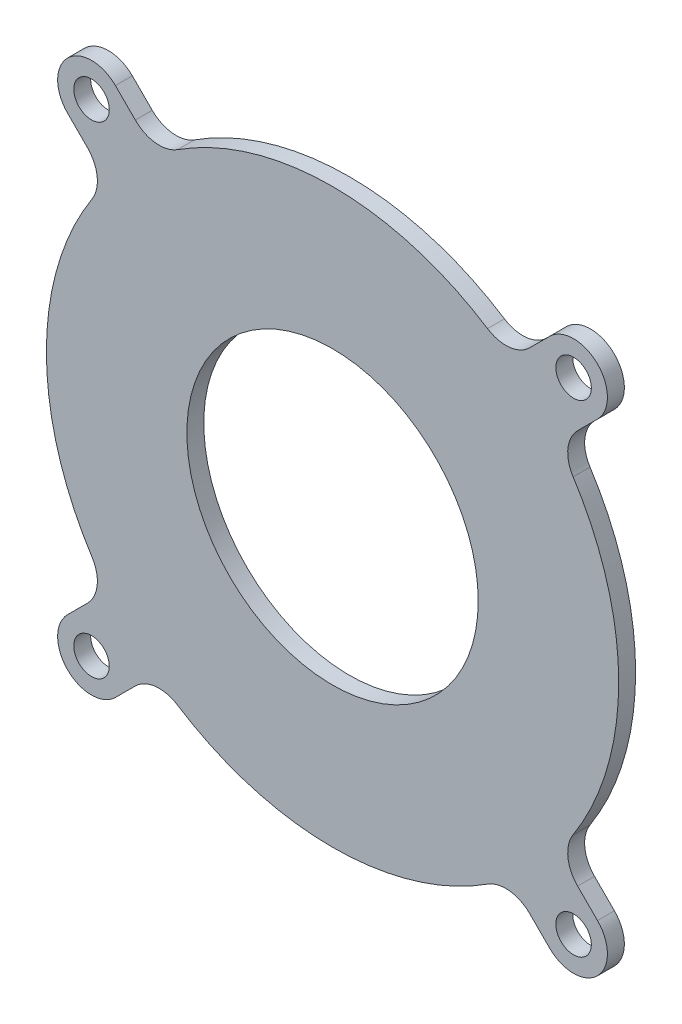
from build123d import *

# Parameters (mm, degrees)
SKETCH_1_R      = 2.1
SKETCH_1_R_2    = 17.225
EXTRUDE_1_DEPTH = 2


with BuildPart() as part:
    # 草图1 → 凸台-拉伸1 (new body)
    with BuildSketch(Plane.XY):
        with BuildLine():
            Line((49.221320344, -54.878174593), (46.870064467, -52.526918716))
            ThreePointArc((46.870064467, -52.526918716), (44.466937039, -51.378020085), (41.875216055, -51.992814233))
            ThreePointArc((41.875216055, -51.992814233), (23.55, -57.385), (5.224783944, -51.992814233))
            ThreePointArc((5.224783944, -51.992814233), (2.633062961, -51.378020085), (0.229935533, -52.526918716))
            Line((0.229935533, -52.526918716), (-2.121320344, -54.878174593))
            ThreePointArc((-2.121320344, -54.878174593), (-7.778174593, -54.878174593), (-7.778174593, -49.221320343))
            Line((-7.778174593, -49.221320343), (-5.426918716, -46.870064466))
            ThreePointArc((-5.426918716, -46.870064466), (-4.278020085, -44.466937039), (-4.892814233, -41.875216055))
            ThreePointArc((-4.892814233, -41.875216055), (-10.285, -23.55), (-4.892814233, -5.224783944))
            ThreePointArc((-4.892814233, -5.224783944), (-4.278020085, -2.633062961), (-5.426918716, -0.229935533))
            Line((-5.426918716, -0.229935533), (-7.778174593, 2.121320344))
            ThreePointArc((-7.778174593, 2.121320344), (-7.778174593, 7.778174593), (-2.121320343, 7.778174593))
            Line((-2.121320343, 7.778174593), (0.229935534, 5.426918716))
            ThreePointArc((0.229935534, 5.426918716), (2.633062962, 4.278020085), (5.224783945, 4.892814234))
            ThreePointArc((5.224783945, 4.892814234), (23.55, 10.285), (41.875216056, 4.892814233))
            ThreePointArc((41.875216056, 4.892814233), (44.466937039, 4.278020085), (46.870064467, 5.426918716))
            Line((46.870064467, 5.426918716), (49.221320344, 7.778174593))
            ThreePointArc((49.221320344, 7.778174593), (54.878174593, 7.778174593), (54.878174593, 2.121320344))
            Line((54.878174593, 2.121320344), (52.526918716, -0.229935533))
            ThreePointArc((52.526918716, -0.229935533), (51.378020085, -2.633062961), (51.992814234, -5.224783945))
            ThreePointArc((51.992814234, -5.224783945), (57.385, -23.55), (51.992814233, -41.875216055))
            ThreePointArc((51.992814233, -41.875216055), (51.378020085, -44.466937039), (52.526918716, -46.870064467))
            Line((52.526918716, -46.870064467), (54.878174593, -49.221320344))
            ThreePointArc((54.878174593, -49.221320344), (54.878174593, -54.878174593), (49.221320344, -54.878174593))
        make_face()
        with Locations((52.049747468, -52.049747468)):
            Circle(SKETCH_1_R, mode=Mode.SUBTRACT)
        with Locations((-4.949747468, -52.049747468)):
            Circle(SKETCH_1_R, mode=Mode.SUBTRACT)
        with Locations((-4.949747468, 4.949747468)):
            Circle(SKETCH_1_R, mode=Mode.SUBTRACT)
        with Locations((52.049747468, 4.949747468)):
            Circle(SKETCH_1_R, mode=Mode.SUBTRACT)
        with Locations((23.55, -23.55)):
            Circle(SKETCH_1_R_2, mode=Mode.SUBTRACT)
    extrude(amount=EXTRUDE_1_DEPTH)


solid = part.part
